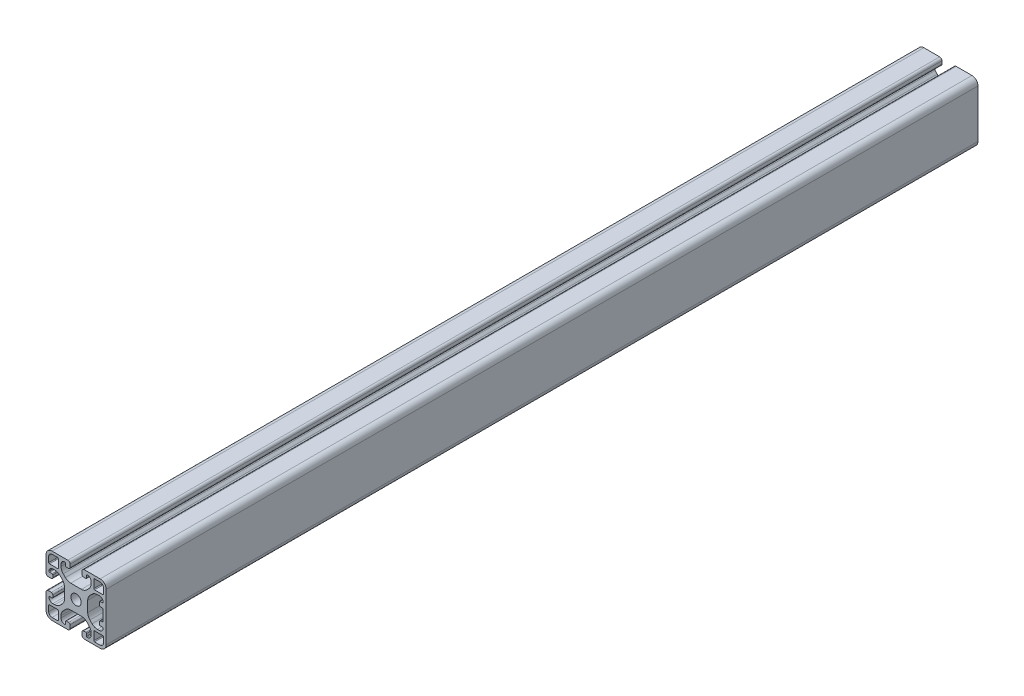
from build123d import *

# Parameters (mm, degrees)
SCHIZZO1_R                   = 3.4
ESTRUSIONE_ESTRUSIONE1_DEPTH = 580


with BuildPart() as part:
    # Schizzo1 → Estrusione-Estrusione1 (new body)
    with BuildSketch(Plane(origin=(0, 0, -340), x_dir=(-1, 0, 0), z_dir=(0, 0, -1))):
        with BuildLine():
            Line((6.5, -15.5), (5, -15.5))
            ThreePointArc((5, -15.5), (4.292893219, -15.792893219), (4, -16.5))
            Line((4, -16.5), (4, -18.5))
            ThreePointArc((4, -18.5), (4.439339828, -19.560660172), (5.5, -20))
            Line((5.5, -20), (16, -20))
            ThreePointArc((16, -20), (18.828427125, -18.828427125), (20, -16))
            Line((20, -16), (20, -5.5))
            ThreePointArc((20, -5.5), (19.560660172, -4.439339828), (18.5, -4))
            Line((18.5, -4), (16.5, -4))
            ThreePointArc((16.5, -4), (15.792893219, -4.292893219), (15.5, -5))
            Line((15.5, -5), (15.5, -6.5))
            ThreePointArc((15.5, -6.5), (15.646446609, -6.853553391), (16, -7))
            Line((16, -7), (17.55, -7))
            ThreePointArc((17.55, -7), (17.868198052, -7.131801948), (18, -7.45))
            Line((18, -7.45), (18, -7.5))
            ThreePointArc((18, -7.5), (17.267766953, -9.267766953), (15.5, -10))
            Line((15.5, -10), (14.192388155, -10))
            ThreePointArc((14.192388155, -10), (12.278970994, -9.619397663), (10.656854249, -8.535533906))
            Line((10.656854249, -8.535533906), (9.214466094, -7.09314575))
            ThreePointArc((9.214466094, -7.09314575), (8.130602337, -5.471029006), (7.75, -3.557611845))
            Line((7.75, -3.557611845), (7.75, 3.557611845))
            ThreePointArc((7.75, 3.557611845), (8.130602337, 5.471029006), (9.214466094, 7.09314575))
            Line((9.214466094, 7.09314575), (10.656854249, 8.535533906))
            ThreePointArc((10.656854249, 8.535533906), (12.278970994, 9.619397663), (14.192388155, 10))
            Line((14.192388155, 10), (15.5, 10))
            ThreePointArc((15.5, 10), (17.267766953, 9.267766953), (18, 7.5))
            Line((18, 7.5), (18, 7.45))
            ThreePointArc((18, 7.45), (17.868198052, 7.131801948), (17.55, 7))
            Line((17.55, 7), (16, 7))
            ThreePointArc((16, 7), (15.646446609, 6.853553391), (15.5, 6.5))
            Line((15.5, 6.5), (15.5, 5))
            ThreePointArc((15.5, 5), (15.792893219, 4.292893219), (16.5, 4))
            Line((16.5, 4), (18.5, 4))
            ThreePointArc((18.5, 4), (19.560660172, 4.439339828), (20, 5.5))
            Line((20, 5.5), (20, 16))
            ThreePointArc((20, 16), (18.828427125, 18.828427125), (16, 20))
            Line((16, 20), (5.5, 20))
            ThreePointArc((5.5, 20), (4.439339828, 19.560660172), (4, 18.5))
            Line((4, 18.5), (4, 16.5))
            ThreePointArc((4, 16.5), (4.292893219, 15.792893219), (5, 15.5))
            Line((5, 15.5), (6.5, 15.5))
            ThreePointArc((6.5, 15.5), (6.853553391, 15.646446609), (7, 16))
            Line((7, 16), (7, 17.55))
            ThreePointArc((7, 17.55), (7.131801948, 17.868198052), (7.45, 18))
            Line((7.45, 18), (7.5, 18))
            ThreePointArc((7.5, 18), (9.267766953, 17.267766953), (10, 15.5))
            Line((10, 15.5), (10, 14.192388155))
            ThreePointArc((10, 14.192388155), (9.619397663, 12.278970994), (8.535533906, 10.656854249))
            Line((8.535533906, 10.656854249), (7.09314575, 9.214466094))
            ThreePointArc((7.09314575, 9.214466094), (5.471029006, 8.130602337), (3.557611844, 7.75))
            Line((3.557611844, 7.75), (-3.557611845, 7.75))
            ThreePointArc((-3.557611845, 7.75), (-5.471029006, 8.130602337), (-7.09314575, 9.214466094))
            Line((-7.09314575, 9.214466094), (-8.535533906, 10.656854249))
            ThreePointArc((-8.535533906, 10.656854249), (-9.619397663, 12.278970994), (-10, 14.192388155))
            Line((-10, 14.192388155), (-10, 15.5))
            ThreePointArc((-10, 15.5), (-9.267766953, 17.267766953), (-7.5, 18))
            Line((-7.5, 18), (-7.45, 18))
            ThreePointArc((-7.45, 18), (-7.131801948, 17.868198052), (-7, 17.55))
            Line((-7, 17.55), (-7, 16))
            ThreePointArc((-7, 16), (-6.853553391, 15.646446609), (-6.5, 15.5))
            Line((-6.5, 15.5), (-5, 15.5))
            ThreePointArc((-5, 15.5), (-4.292893219, 15.792893219), (-4, 16.5))
            Line((-4, 16.5), (-4, 18.5))
            ThreePointArc((-4, 18.5), (-4.439339828, 19.560660172), (-5.5, 20))
            Line((-5.5, 20), (-16, 20))
            ThreePointArc((-16, 20), (-18.828427125, 18.828427125), (-20, 16))
            Line((-20, 16), (-20, -16))
            ThreePointArc((-20, -16), (-18.828427125, -18.828427125), (-16, -20))
            Line((-16, -20), (-5.5, -20))
            ThreePointArc((-5.5, -20), (-4.439339828, -19.560660172), (-4, -18.5))
            Line((-4, -18.5), (-4, -16.5))
            ThreePointArc((-4, -16.5), (-4.292893219, -15.792893219), (-5, -15.5))
            Line((-5, -15.5), (-6.5, -15.5))
            ThreePointArc((-6.5, -15.5), (-6.853553391, -15.646446609), (-7, -16))
            Line((-7, -16), (-7, -17.55))
            ThreePointArc((-7, -17.55), (-7.131801948, -17.868198052), (-7.45, -18))
            Line((-7.45, -18), (-7.5, -18))
            ThreePointArc((-7.5, -18), (-9.267766953, -17.267766953), (-10, -15.5))
            Line((-10, -15.5), (-10, -14.192388155))
            ThreePointArc((-10, -14.192388155), (-9.619397663, -12.278970994), (-8.535533906, -10.656854249))
            Line((-8.535533906, -10.656854249), (-7.09314575, -9.214466094))
            ThreePointArc((-7.09314575, -9.214466094), (-5.471029006, -8.130602337), (-3.557611845, -7.75))
            Line((-3.557611845, -7.75), (3.557611845, -7.75))
            ThreePointArc((3.557611845, -7.75), (5.471029006, -8.130602337), (7.09314575, -9.214466094))
            Line((7.09314575, -9.214466094), (8.535533906, -10.656854249))
            ThreePointArc((8.535533906, -10.656854249), (9.619397663, -12.278970994), (10, -14.192388155))
            Line((10, -14.192388155), (10, -15.5))
            ThreePointArc((10, -15.5), (9.267766953, -17.267766953), (7.5, -18))
            Line((7.5, -18), (7.45, -18))
            ThreePointArc((7.45, -18), (7.131801948, -17.868198052), (7, -17.55))
            Line((7, -17.55), (7, -16))
            ThreePointArc((7, -16), (6.853553391, -15.646446609), (6.5, -15.5))
        make_face()
        with Locations(Location((0, 0, 0), (0, 0, 180))):
            Circle(SCHIZZO1_R, mode=Mode.SUBTRACT)
        with BuildLine():
            Line((-12.3, -18.2), (-16, -18.2))
            ThreePointArc((-16, -18.2), (-17.555634919, -17.555634919), (-18.2, -16))
            Line((-18.2, -16), (-18.2, -12.3))
            ThreePointArc((-18.2, -12.3), (-18.053553391, -11.946446609), (-17.7, -11.8))
            Line((-17.7, -11.8), (-12.3, -11.8))
            ThreePointArc((-12.3, -11.8), (-11.946446609, -11.946446609), (-11.8, -12.3))
            Line((-11.8, -12.3), (-11.8, -17.7))
            ThreePointArc((-11.8, -17.7), (-11.946446609, -18.053553391), (-12.3, -18.2))
        make_face(mode=Mode.SUBTRACT)
        with BuildLine():
            Line((-11.8, 17.7), (-11.8, 12.3))
            ThreePointArc((-11.8, 12.3), (-11.946446609, 11.946446609), (-12.3, 11.8))
            Line((-12.3, 11.8), (-17.7, 11.8))
            ThreePointArc((-17.7, 11.8), (-18.053553391, 11.946446609), (-18.2, 12.3))
            Line((-18.2, 12.3), (-18.2, 16))
            ThreePointArc((-18.2, 16), (-17.555634919, 17.555634919), (-16, 18.2))
            Line((-16, 18.2), (-12.3, 18.2))
            ThreePointArc((-12.3, 18.2), (-11.946446609, 18.053553391), (-11.8, 17.7))
        make_face(mode=Mode.SUBTRACT)
        with BuildLine():
            Line((18.2, 16), (18.2, 12.3))
            ThreePointArc((18.2, 12.3), (18.053553391, 11.946446609), (17.7, 11.8))
            Line((17.7, 11.8), (12.3, 11.8))
            ThreePointArc((12.3, 11.8), (11.946446609, 11.946446609), (11.8, 12.3))
            Line((11.8, 12.3), (11.8, 17.7))
            ThreePointArc((11.8, 17.7), (11.946446609, 18.053553391), (12.3, 18.2))
            Line((12.3, 18.2), (16, 18.2))
            ThreePointArc((16, 18.2), (17.555634919, 17.555634919), (18.2, 16))
        make_face(mode=Mode.SUBTRACT)
        with BuildLine():
            Line((18.2, -12.3), (18.2, -16))
            ThreePointArc((18.2, -16), (17.555634919, -17.555634919), (16, -18.2))
            Line((16, -18.2), (12.3, -18.2))
            ThreePointArc((12.3, -18.2), (11.946446609, -18.053553391), (11.8, -17.7))
            Line((11.8, -17.7), (11.8, -12.3))
            ThreePointArc((11.8, -12.3), (11.946446609, -11.946446609), (12.3, -11.8))
            Line((12.3, -11.8), (17.7, -11.8))
            ThreePointArc((17.7, -11.8), (18.053553391, -11.946446609), (18.2, -12.3))
        make_face(mode=Mode.SUBTRACT)
        with BuildLine():
            Line((-16, 7), (-17.5, 7))
            ThreePointArc((-17.5, 7), (-17.853553391, 7.146446609), (-18, 7.5))
            ThreePointArc((-18, 7.5), (-17.267766953, 9.267766953), (-15.5, 10))
            Line((-15.5, 10), (-14.192388155, 10))
            ThreePointArc((-14.192388155, 10), (-12.278970994, 9.619397663), (-10.656854249, 8.535533906))
            Line((-10.656854249, 8.535533906), (-9.214466094, 7.093145751))
            ThreePointArc((-9.214466094, 7.093145751), (-8.130602337, 5.471029006), (-7.75, 3.557611845))
            Line((-7.75, 3.557611845), (-7.75, -3.557611845))
            ThreePointArc((-7.75, -3.557611845), (-8.130602337, -5.471029006), (-9.214466094, -7.093145751))
            Line((-9.214466094, -7.093145751), (-10.656854249, -8.535533906))
            ThreePointArc((-10.656854249, -8.535533906), (-12.278970994, -9.619397663), (-14.192388155, -10))
            Line((-14.192388155, -10), (-15.5, -10))
            ThreePointArc((-15.5, -10), (-17.267766953, -9.267766953), (-18, -7.5))
            ThreePointArc((-18, -7.5), (-17.853553391, -7.146446609), (-17.5, -7))
            Line((-17.5, -7), (-16, -7))
            ThreePointArc((-16, -7), (-15.646446609, -6.853553391), (-15.5, -6.5))
            Line((-15.5, -6.5), (-15.5, -5))
            ThreePointArc((-15.5, -5), (-15.792893219, -4.292893219), (-16.5, -4))
            Line((-16.5, -4), (-17.5, -4))
            ThreePointArc((-17.5, -4), (-17.853553391, -3.853553391), (-18, -3.5))
            Line((-18, -3.5), (-18, 3.5))
            ThreePointArc((-18, 3.5), (-17.853553391, 3.853553391), (-17.5, 4))
            Line((-17.5, 4), (-16.5, 4))
            ThreePointArc((-16.5, 4), (-15.792893219, 4.292893219), (-15.5, 5))
            Line((-15.5, 5), (-15.5, 6.5))
            ThreePointArc((-15.5, 6.5), (-15.646446609, 6.853553391), (-16, 7))
        make_face(mode=Mode.SUBTRACT)
    extrude(amount=-ESTRUSIONE_ESTRUSIONE1_DEPTH)


solid = part.part
